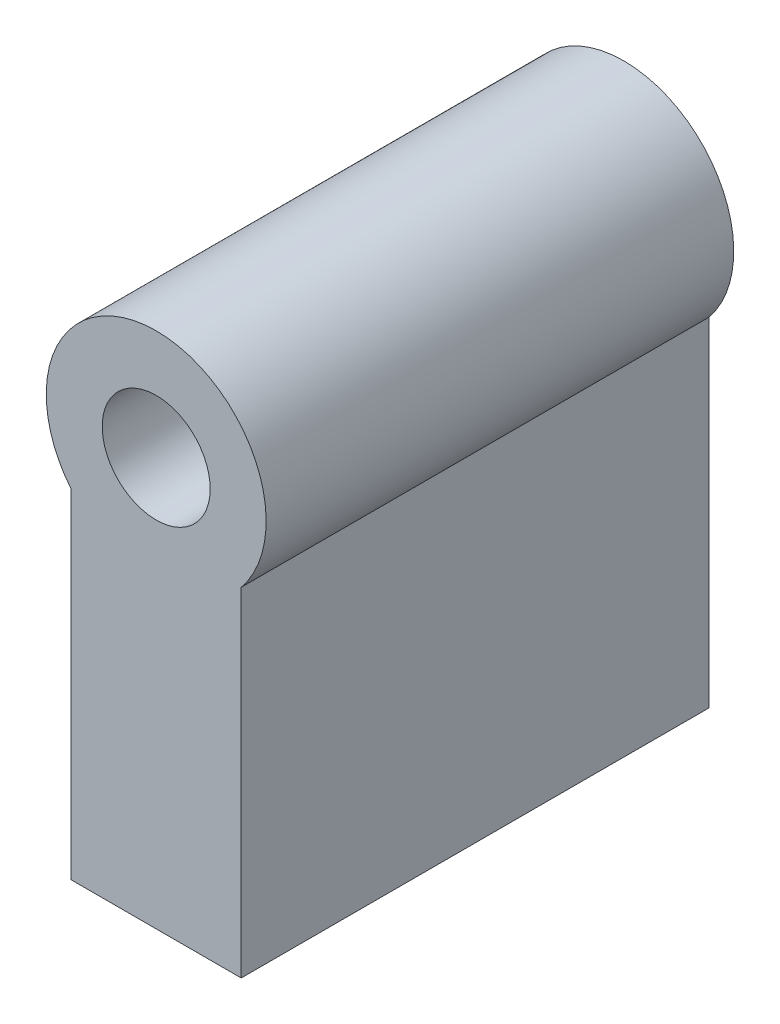
from build123d import *

# Parameters (mm, degrees)
SALIENTE_EXTRUIR1_DEPTH = 55
CROQUIS2_R              = 6.35
CORTAR_EXTRUIR1_DEPTH   = 55


with BuildPart() as part:
    # Croquis1 → Saliente-Extruir1 (new body)
    with BuildSketch(Plane.XY):
        with BuildLine():
            Line((0, 0), (0, -35))
            Line((0, -35), (20, -35))
            Line((20, -35), (20, 0))
            Line((20, 0), (20, 4.801960973))
            ThreePointArc((20, 4.801960973), (10, 25.930887204), (0, 4.801960973))
            Line((0, 4.801960973), (0, 0))
        make_face()
    extrude(amount=SALIENTE_EXTRUIR1_DEPTH)

    # Croquis2 → Cortar-Extruir1 (cut)
    with BuildSketch(Plane.XY.offset(55)):
        with Locations((10, 13)):
            Circle(CROQUIS2_R)
    extrude(amount=-CORTAR_EXTRUIR1_DEPTH, mode=Mode.SUBTRACT)


solid = part.part
